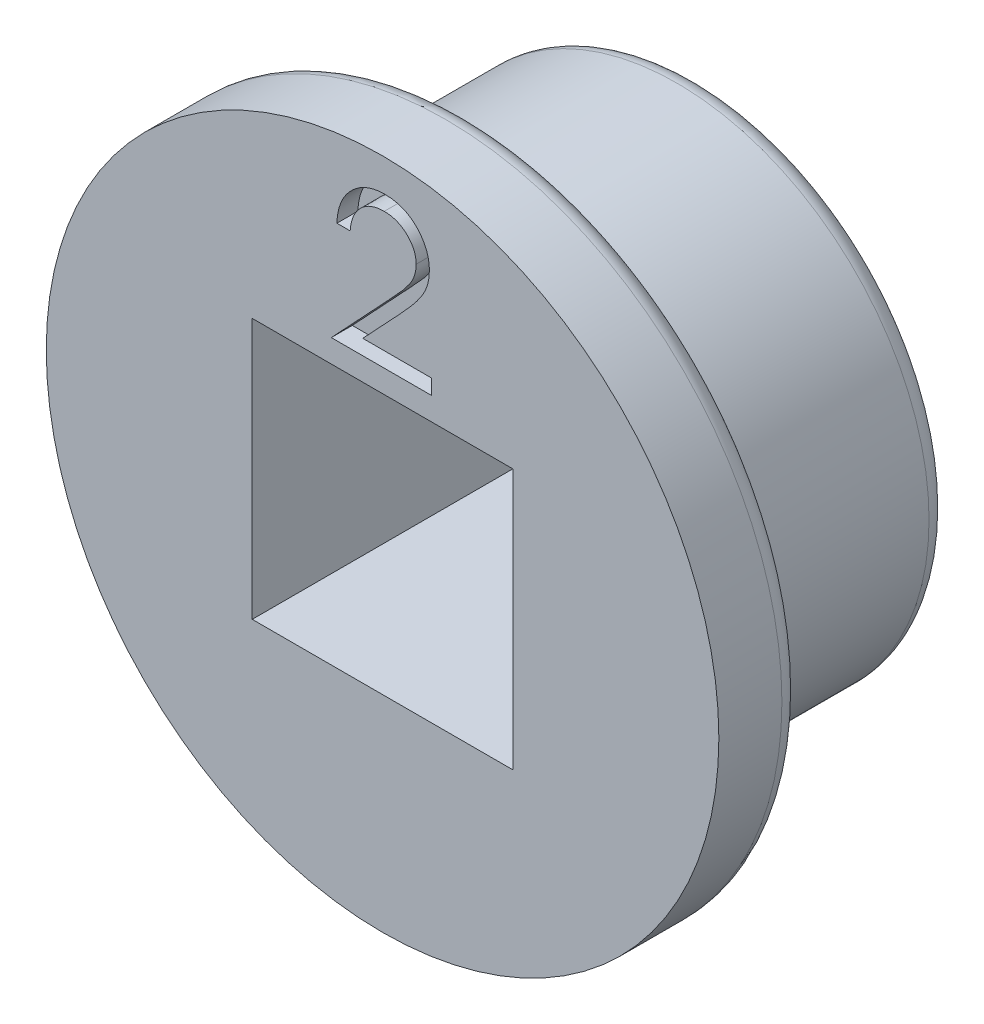
from build123d import *

# Parameters (mm, degrees)
SKETCH1_R           = 6
SKETCH1_W           = 6.2
SKETCH1_H           = 6.2
BOSS_EXTRUDE1_DEPTH = 5.5
SKETCH1_3_R         = 8
SKETCH1_3_W         = 6.2
SKETCH1_3_H         = 6.2
BOSS_EXTRUDE2_DEPTH = 2
FILLET1_R           = 0.5
CUT_EXTRUDE1_DEPTH  = 0.5


with BuildPart() as part:
    # Sketch1 → Boss-Extrude1 (new body)
    with BuildSketch(Plane.XY):
        Circle(SKETCH1_R)
        Rectangle(SKETCH1_W, SKETCH1_H, mode=Mode.SUBTRACT)
    extrude(amount=-BOSS_EXTRUDE1_DEPTH)

    # Sketch1<3> → Boss-Extrude2 (add)
    with BuildSketch(Plane.XY):
        Circle(SKETCH1_3_R)
        Rectangle(SKETCH1_3_W, SKETCH1_3_H, mode=Mode.SUBTRACT)
    extrude(amount=BOSS_EXTRUDE2_DEPTH)

    # Fillet1
    fillet1_edges = [part.edges().sort_by_distance(p)[0] for p in [
        (-8, 0, 0),
        (-6, 0, -5.5),
    ]]
    fillet(fillet1_edges, radius=FILLET1_R)

    # Sketch2 → Cut-Extrude1 (cut)
    with BuildSketch(Plane.XY.offset(2)):
        with BuildLine():
            Line((-0.770976701, 6.067937408), (-1.085079266, 6.067937408))
            add(Edge.make_bspline(
                [(-1.085079266, 6.067937408), (-1.083032113, 6.109608296), (-1.079011558, 6.19144881), (-1.060183269, 6.310772717), (-1.033242392, 6.424827515), (-0.995150938, 6.532697429), (-0.94784466, 6.635336237), (-0.891114633, 6.732336252), (-0.823920782, 6.823327441), (-0.747714048, 6.907466284), (-0.664945409, 6.984653855), (-0.57563947, 7.051309098), (-0.481794442, 7.107626769), (-0.383695044, 7.154708011), (-0.28023448, 7.190047857), (-0.172351622, 7.216269497), (-0.059572486, 7.232045842), (0.017267536, 7.233741628), (0.056347017, 7.234604075)],
                knots=[0, 0, 0, 0, 1.10065271, 2.161652631, 3.183658789, 4.190468796, 5.17591951, 6.163126047, 7.15150782, 8.156236427, 9.156009102, 10.134482811, 11.092018607, 12.041330605, 13.001268258, 13.972401359, 14.968799086, 16, 16, 16, 16], degree=3))
            add(Edge.make_bspline(
                [(0.056347017, 7.234604075), (0.094725091, 7.233705618), (0.170136635, 7.231940183), (0.28019865, 7.216779154), (0.384975944, 7.193033562), (0.484263711, 7.159718146), (0.577269775, 7.114933719), (0.66469282, 7.06113618), (0.747573631, 6.998916349), (0.822180414, 6.925662535), (0.890688493, 6.847460151), (0.949790749, 6.763972247), (1.000403912, 6.677742961), (1.042591592, 6.58811476), (1.073647731, 6.494243731), (1.097225939, 6.397496529), (1.110553353, 6.296871718), (1.112598776, 6.228765162), (1.113638683, 6.194139331)],
                knots=[0, 0, 0, 0, 1.111607364, 2.184268762, 3.212621178, 4.221274766, 5.211760367, 6.196651075, 7.1921475, 8.207485113, 9.220403448, 10.201281604, 11.166441695, 12.114753415, 13.065576456, 14.026450734, 14.996634279, 16, 16, 16, 16], degree=3))
            add(Edge.make_bspline(
                [(1.113638683, 6.194139331), (1.11194542, 6.145391496), (1.108588609, 6.048751283), (1.079874232, 5.90673642), (1.035027721, 5.769143001), (0.981030364, 5.658405699), (0.92655792, 5.569172205), (0.877470413, 5.4957035), (0.820005602, 5.416598032), (0.753327104, 5.332120694), (0.678814232, 5.241609789), (0.595792068, 5.145119994), (0.503668586, 5.043648224), (0.439010086, 4.974342623), (0.40550567, 4.938430196)],
                knots=[0, 0, 0, 0, 1.184426356, 2.348067706, 3.509069118, 4.696110526, 5.333549288, 6.050745305, 6.844228056, 7.710549037, 8.667450064, 9.695053472, 10.805634456, 12, 12, 12, 12], degree=3))
            Line((0.40550567, 4.938430196), (-0.470195451, 4.003834844))
            Line((-0.470195451, 4.003834844), (1.158510478, 4.003834844))
            Line((1.158510478, 4.003834844), (1.158510478, 3.644860485))
            Line((1.158510478, 3.644860485), (-1.21969465, 3.644860485))
            Line((-1.21969465, 3.644860485), (0.137677145, 5.093378113))
            add(Edge.make_bspline(
                [(0.137677145, 5.093378113), (0.170725032, 5.12787642), (0.234203259, 5.194140606), (0.323985835, 5.290883566), (0.404624824, 5.380633107), (0.476642217, 5.463219656), (0.538475722, 5.539851223), (0.593347954, 5.608045927), (0.637313545, 5.670800377), (0.685028941, 5.743540991), (0.731242922, 5.832353308), (0.770955278, 5.940886998), (0.795170126, 6.05261425), (0.798074962, 6.128116287), (0.799536119, 6.166094459)],
                knots=[0, 0, 0, 0, 1.329631726, 2.553950428, 3.673215718, 4.687767853, 5.603093632, 6.413772471, 7.123043292, 7.734684054, 8.834405432, 9.900288307, 10.943827018, 12, 12, 12, 12], degree=3))
            add(Edge.make_bspline(
                [(0.799536119, 6.166094459), (0.798900377, 6.189975858), (0.797647451, 6.237041508), (0.786589753, 6.306047267), (0.769879247, 6.372612081), (0.745933989, 6.4369407), (0.714327249, 6.498386352), (0.675853869, 6.557023832), (0.631463806, 6.613712797), (0.580112536, 6.666866095), (0.523701017, 6.715547301), (0.464106767, 6.758671386), (0.401056663, 6.794710497), (0.334816541, 6.824253994), (0.265571071, 6.847429376), (0.193186326, 6.863487955), (0.11786231, 6.873570439), (0.066428814, 6.874934611), (0.040221215, 6.875629716)],
                knots=[0, 0, 0, 0, 0.991446411, 1.95395049, 2.89581595, 3.838931463, 4.798493298, 5.75982156, 6.748411868, 7.785213223, 8.824556874, 9.840280684, 10.836137867, 11.835679398, 12.848801643, 13.863922112, 14.911575587, 16, 16, 16, 16], degree=3))
            add(Edge.make_bspline(
                [(0.040221215, 6.875629716), (0.012850382, 6.874914683), (-0.040901414, 6.873510478), (-0.119820447, 6.863687814), (-0.195106224, 6.846741974), (-0.266948127, 6.823565299), (-0.335467713, 6.79410675), (-0.400331757, 6.757415006), (-0.461394646, 6.713631513), (-0.51877117, 6.663990956), (-0.571635149, 6.608723355), (-0.618082025, 6.547113392), (-0.658666039, 6.480285977), (-0.694075272, 6.408421426), (-0.722830962, 6.330867646), (-0.744804113, 6.247899941), (-0.762190959, 6.15987856), (-0.76799948, 6.099093475), (-0.770976701, 6.067937408)],
                knots=[0, 0, 0, 0, 1.031018746, 2.02475058, 2.990194455, 3.934040569, 4.864654155, 5.795059489, 6.735614925, 7.690564532, 8.649604399, 9.611025574, 10.590972636, 11.591080095, 12.624614302, 13.701020113, 14.821632451, 16, 16, 16, 16], degree=3))
        make_face()
    extrude(amount=-CUT_EXTRUDE1_DEPTH, mode=Mode.SUBTRACT)


solid = part.part
